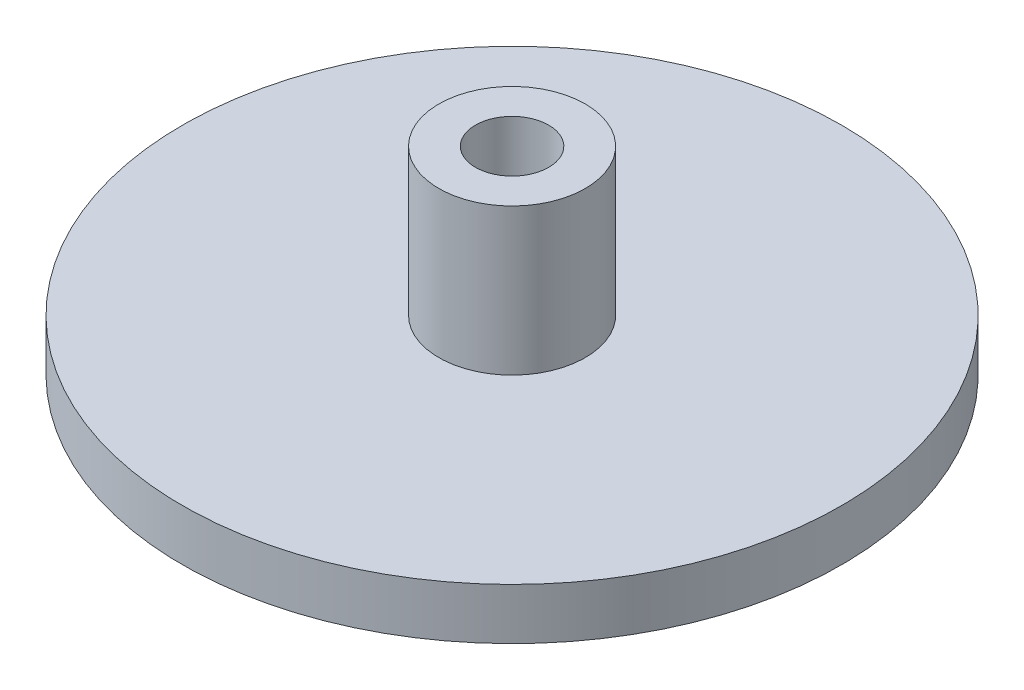
from build123d import *


with BuildPart() as part:
    # Sketch1 → Revolve1 (revolve)
    with BuildSketch(Plane.XY, mode=Mode.PRIVATE) as revolve1_sk:
        Polygon((1, 0), (1, 5.4), (2, 5.4), (2, 1.4), (9, 1.4), (9, 0), align=None)
    revolve(revolve1_sk.sketch.rotate(Axis((0, 0, 0), (0, 1, 0)), 90), axis=Axis((0, 0, 0), (0, 1, 0)))


solid = part.part
